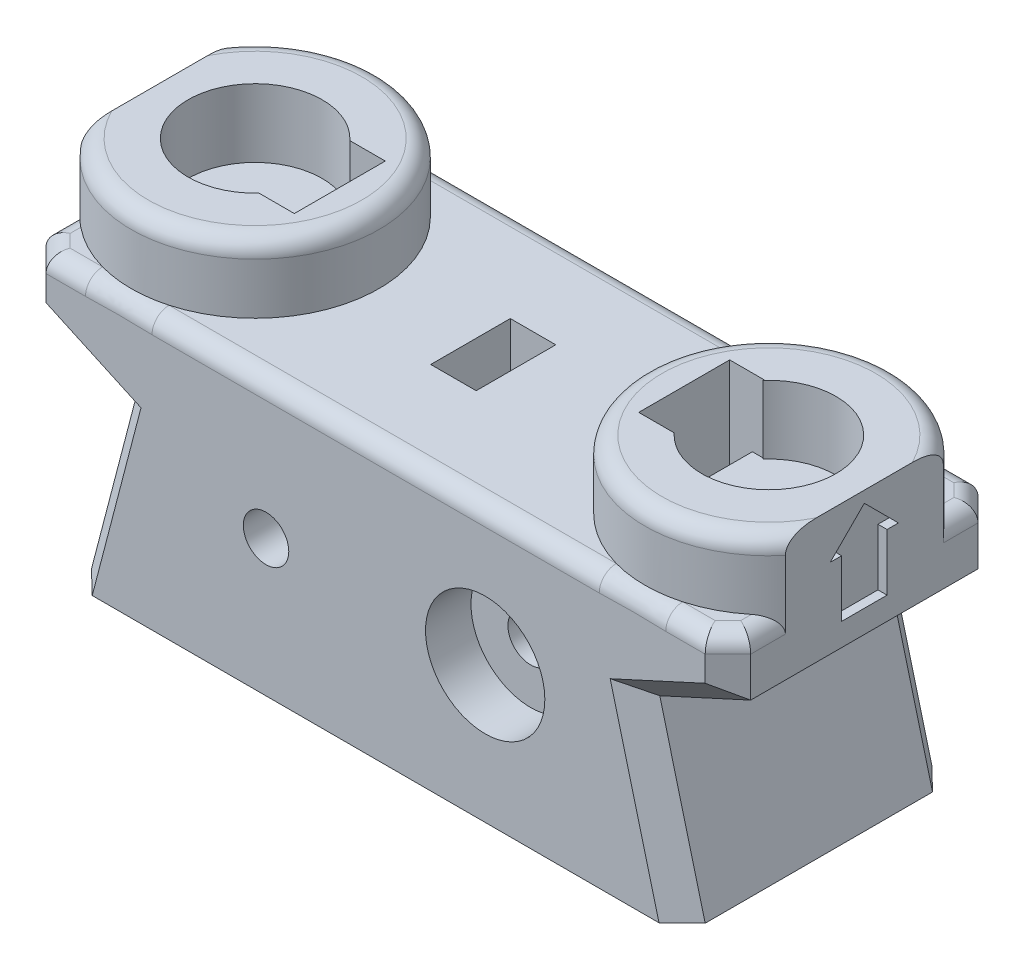
from build123d import *

# Parameters (mm, degrees)
SKETCH1_W           = 31
SKETCH1_H           = 15
BOSS_EXTRUDE1_DEPTH = 6
SKETCH2_W           = 20.15
SKETCH2_H           = 6.15
CUT_EXTRUDE1_DEPTH  = 13
SKETCH6_R           = 5.45
SKETCH6_R_2         = 2.95
BOSS_EXTRUDE3_DEPTH = 3
CUT_EXTRUDE3_REACH  = 24.035
SKETCH3_W           = 1
SKETCH3_H           = 4
SKETCH3_W_2         = 2
SKETCH3_H_2         = 3.5
CUT_EXTRUDE4_START  = -3
SKETCH7_W           = 0.511909323
SKETCH7_H           = 0.870011062
SKETCH7_W_2         = 0.855337353
SKETCH7_H_2         = 1.408005392
CUT_EXTRUDE4_DEPTH  = 3
SKETCH8_W           = 31
SKETCH8_H           = 12
CUT_EXTRUDE5_DEPTH  = 3
CUT_EXTRUDE6_REACH  = 25.126
SKETCH9_R           = 1
SKETCH10_R          = 2.625
CUT_EXTRUDE7_DEPTH  = 2
SKETCH11_R          = 2.625
CUT_EXTRUDE8_DEPTH  = 2
CUT_EXTRUDE9_DEPTH  = 15
FILLET3_R           = 0.75
CUT_EXTRUDE10_DEPTH = 12
CHAMFER2_SIZE       = 1
FILLET4_R           = 0.75
CHAMFER3_SIZE       = 1.25
CUT_EXTRUDE11_DEPTH = 0.4


with BuildPart() as part:
    # Sketch1 → Boss-Extrude1 (new, symmetric)
    with BuildSketch(Plane.XY):
        Rectangle(SKETCH1_W, SKETCH1_H)
    extrude(amount=BOSS_EXTRUDE1_DEPTH, both=True)

    # Sketch2 → Cut-Extrude1 (cut)
    with BuildSketch(Plane.XZ.offset(7.5)):
        Rectangle(SKETCH2_W, SKETCH2_H)
    extrude(amount=-CUT_EXTRUDE1_DEPTH, mode=Mode.SUBTRACT)

    # Sketch6 → Boss-Extrude3 (add)
    # profile 1 of 2: a face of its own
    with BuildSketch(Plane(origin=(0, 7.5, 0), x_dir=(1, 0, 0), z_dir=(0, 1, 0))):
        with Locations(Location((-11.3, 0, 0), (0, 0, 140.41159309))):
            Circle(SKETCH6_R)
        with Locations(Location((-11.3, 0, 0), (0, 0, 270))):
            Circle(SKETCH6_R_2, mode=Mode.SUBTRACT)
    # profile 2 of 2: a face of its own
    with BuildSketch(Plane(origin=(0, 7.5, 0), x_dir=(1, 0, 0), z_dir=(0, 1, 0))):
        with Locations(Location((11.3, 0, 0), (0, 0, 39.58840691))):
            Circle(SKETCH6_R)
        with Locations(Location((11.3, 0, 0), (0, 0, 270))):
            Circle(SKETCH6_R_2, mode=Mode.SUBTRACT)
    extrude(amount=BOSS_EXTRUDE3_DEPTH)

    # Cut-Extrude3: up to this face of the body (flat: up to its plane)
    cut_extrude3_end = Plane(part.part.faces().sort_by_distance((-7.218793939, 10.5, 3.374876584))[0])
    # Sketch3 → Cut-Extrude3 (cut, up to the picked face)
    with BuildSketch(Plane.XZ.offset(-5.5), mode=Mode.PRIVATE) as cut_extrude3_sk1:
        with Locations((8.075, 0)):
            Rectangle(SKETCH3_W, SKETCH3_H)
    cut_extrude3_tool1 = split(extrude(cut_extrude3_sk1.sketch, amount=-CUT_EXTRUDE3_REACH, mode=Mode.PRIVATE), bisect_by=cut_extrude3_end, keep=Keep.BOTH, mode=Mode.PRIVATE)
    # Sketch3 → Cut-Extrude3 (cut, up to the picked face)
    with BuildSketch(Plane.XZ.offset(-5.5), mode=Mode.PRIVATE) as cut_extrude3_sk2:
        with Locations((-8.075, 0)):
            Rectangle(SKETCH3_W, SKETCH3_H)
    cut_extrude3_tool2 = split(extrude(cut_extrude3_sk2.sketch, amount=-CUT_EXTRUDE3_REACH, mode=Mode.PRIVATE), bisect_by=cut_extrude3_end, keep=Keep.BOTH, mode=Mode.PRIVATE)
    # Sketch3 → Cut-Extrude3 (cut, up to the picked face)
    with BuildSketch(Plane.XZ.offset(-5.5), mode=Mode.PRIVATE) as cut_extrude3_sk3:
        with Locations((-0.825, 0)):
            Rectangle(SKETCH3_W_2, SKETCH3_H_2)
    cut_extrude3_tool3 = split(extrude(cut_extrude3_sk3.sketch, amount=-CUT_EXTRUDE3_REACH, mode=Mode.PRIVATE), bisect_by=cut_extrude3_end, keep=Keep.BOTH, mode=Mode.PRIVATE)
    add(cut_extrude3_tool1.solids().sort_by(Axis((8.075, 5.5, 0), (0, 1, 0)))[0], mode=Mode.SUBTRACT)
    add(cut_extrude3_tool2.solids().sort_by(Axis((-8.075, 5.5, 0), (0, 1, 0)))[0], mode=Mode.SUBTRACT)
    add(cut_extrude3_tool3.solids().sort_by(Axis((-0.825, 5.5, 0), (0, 1, 0)))[0], mode=Mode.SUBTRACT)

    # Sketch7 → Cut-Extrude4 (cut)
    with BuildSketch(Plane(origin=(0, 10.5, 0), x_dir=(1, 0, 0), z_dir=(0, 1, 0)).offset(CUT_EXTRUDE4_START)):
        with BuildLine():
            ThreePointArc((-8.575, 1.129988938), (-8.814868985, 1.58953573), (-9.131475156, 2))
            Line((-9.131475156, 2), (-9.143163494, 2))
            Line((-9.143163494, 2), (-9.143163494, 0.699379733))
            Line((-9.143163494, 0.699379733), (-8.575, 0.699379733))
            Line((-8.575, 0.699379733), (-8.575, 1.129988938))
        make_face()
        with BuildLine():
            Line((-8.575, 1.129988938), (-8.575, 2))
            Line((-8.575, 2), (-9.131475156, 2))
            ThreePointArc((-9.131475156, 2), (-8.814868985, 1.58953573), (-8.575, 1.129988938))
        make_face()
        with BuildLine():
            ThreePointArc((-8.575, -1.129988938), (-8.814868985, -1.58953573), (-9.131475156, -2))
            Line((-9.131475156, -2), (-8.575, -2))
            Line((-8.575, -2), (-8.575, -1.129988938))
        make_face()
        with BuildLine():
            Line((-9.143163494, -2), (-9.131475156, -2))
            ThreePointArc((-9.131475156, -2), (-8.814868985, -1.58953573), (-8.575, -1.129988938))
            Line((-8.575, -1.129988938), (-8.575, -0.709964508))
            Line((-8.575, -0.709964508), (-9.143163494, -0.709964508))
            Line((-9.143163494, -0.709964508), (-9.143163494, -2))
        make_face()
        with Locations((8.830954662, 1.564994469)):
            Rectangle(SKETCH7_W, SKETCH7_H)
        with Locations((9.002668677, -1.295997304)):
            Rectangle(SKETCH7_W_2, SKETCH7_H_2)
    extrude(amount=CUT_EXTRUDE4_DEPTH, mode=Mode.SUBTRACT)

    # Sketch8 → Cut-Extrude5 (cut)
    with BuildSketch(Plane.XZ.offset(7.5)):
        Rectangle(SKETCH8_W, SKETCH8_H)
    extrude(amount=-CUT_EXTRUDE5_DEPTH, mode=Mode.SUBTRACT)

    # Cut-Extrude6: up to this face of the body (flat: up to its plane)
    cut_extrude6_end = Plane(part.part.faces().sort_by_distance((0, 1.5, -6))[0])
    # Sketch9 → Cut-Extrude6 (cut, up to the picked face)
    with BuildSketch(Plane.XY.offset(6), mode=Mode.PRIVATE) as cut_extrude6_sk1:
        with Locations((4.82, 1.5)):
            Circle(SKETCH9_R)
    cut_extrude6_tool1 = split(extrude(cut_extrude6_sk1.sketch, amount=-CUT_EXTRUDE6_REACH, mode=Mode.PRIVATE), bisect_by=cut_extrude6_end, keep=Keep.BOTH, mode=Mode.PRIVATE)
    # Sketch9 → Cut-Extrude6 (cut, up to the picked face)
    with BuildSketch(Plane.XY.offset(6), mode=Mode.PRIVATE) as cut_extrude6_sk2:
        with Locations((-4.82, 1.5)):
            Circle(SKETCH9_R)
    cut_extrude6_tool2 = split(extrude(cut_extrude6_sk2.sketch, amount=-CUT_EXTRUDE6_REACH, mode=Mode.PRIVATE), bisect_by=cut_extrude6_end, keep=Keep.BOTH, mode=Mode.PRIVATE)
    add(cut_extrude6_tool1.solids().sort_by(Axis((4.82, 1.5, 6), (0, 0, -1)))[0], mode=Mode.SUBTRACT)
    add(cut_extrude6_tool2.solids().sort_by(Axis((-4.82, 1.5, 6), (0, 0, -1)))[0], mode=Mode.SUBTRACT)

    # Sketch10 → Cut-Extrude7 (cut)
    with BuildSketch(Plane.XY.offset(6)):
        with Locations((4.82, 1.5)):
            Circle(SKETCH10_R)
    extrude(amount=-CUT_EXTRUDE7_DEPTH, mode=Mode.SUBTRACT)

    # Sketch11 → Cut-Extrude8 (cut)
    with BuildSketch(Plane(origin=(0, 0, -6), x_dir=(-1, 0, 0), z_dir=(0, 0, -1))):
        with Locations((4.82, 1.5)):
            Circle(SKETCH11_R)
    extrude(amount=-CUT_EXTRUDE8_DEPTH, mode=Mode.SUBTRACT)

    # Sketch12 → Cut-Extrude9 (cut)
    with BuildSketch(Plane.XZ.offset(4.5)):
        with BuildLine():
            Line((15.5, 3.473110997), (15.5, -3.473110997))
            ThreePointArc((15.5, -3.473110997), (16.75, 0), (15.5, 3.473110997))
        make_face()
        with BuildLine():
            Line((-15.5, -3.473110997), (-15.5, 3.473110997))
            ThreePointArc((-15.5, 3.473110997), (-16.75, 0), (-15.5, -3.473110997))
        make_face()
    extrude(amount=-CUT_EXTRUDE9_DEPTH, mode=Mode.SUBTRACT)

    # Fillet3
    fillet3_edges = [part.edges().sort_by_distance(p)[0] for p in [
        (-5.85, 10.5, 0),
        (5.85, 10.5, 0),
    ]]
    fillet(fillet3_edges, radius=FILLET3_R)

    # Sketch13 → Cut-Extrude10 (cut)
    with BuildSketch(Plane.XY.offset(6)):
        Polygon((13.5, -4.5), (11.5, 3.166935416), (15.5, 5), (15.5, -4.5), align=None)
        Polygon((-15.5, 5), (-15.5, -4.5), (-13.5, -4.5), (-11.5, 3.166935416), align=None)
    extrude(amount=-CUT_EXTRUDE10_DEPTH, mode=Mode.SUBTRACT)

    # Chamfer2
    chamfer2_edges = [part.edges().sort_by_distance(p)[0] for p in [
        (-15.5, 6.25, 6),
        (15.5, 6.25, -6),
        (15.5, 6.25, 6),
        (13.5, 4.083467708, 6),
        (12.5, -0.666532292, 6),
        (12.5, -0.666532292, -6),
        (13.5, 4.083467708, -6),
        (-13.5, 4.083467708, 6),
        (-12.5, -0.666532292, 6),
        (-13.5, 4.083467708, -6),
        (-12.5, -0.666532292, -6),
        (-15.5, 6.25, -6),
    ]]
    chamfer(chamfer2_edges, length=CHAMFER2_SIZE)

    # Fillet4
    fillet4_edges = [part.edges().sort_by_distance(p)[0] for p in [
        (15.5, 7.5, -4.236555499),
        (0, 7.5, 6),
        (-15.5, 7.5, 4.236555499),
        (15.5, 7.5, 4.236555499),
        (0, 7.5, -6),
        (-15, 7.5, 5.5),
        (-15, 7.5, -5.5),
        (15, 7.5, -5.5),
        (15, 7.5, 5.5),
        (-15.5, 7.5, -4.236555499),
    ]]
    fillet(fillet4_edges, radius=FILLET4_R)

    # Chamfer3
    chamfer3_edges = [part.edges().sort_by_distance(p)[0] for p in [
        (0, -4.5, 3.075),
        (10.075, -4.5, 0),
        (0, -4.5, -3.075),
        (-10.075, -4.5, 0),
    ]]
    chamfer(chamfer3_edges, length=CHAMFER3_SIZE)

    # Sketch14 → Cut-Extrude11 (cut)
    with BuildSketch(Plane(origin=(15.5, 0, 0), x_dir=(0, 0, -1), z_dir=(1, 0, 0))):
        Polygon((-1, 6), (1, 6), (1, 8.5), (1.5, 8.5), (0, 10), (-1.5, 8.5), (-1, 8.5), align=None)
    extrude(amount=-CUT_EXTRUDE11_DEPTH, mode=Mode.SUBTRACT)


solid = part.part
